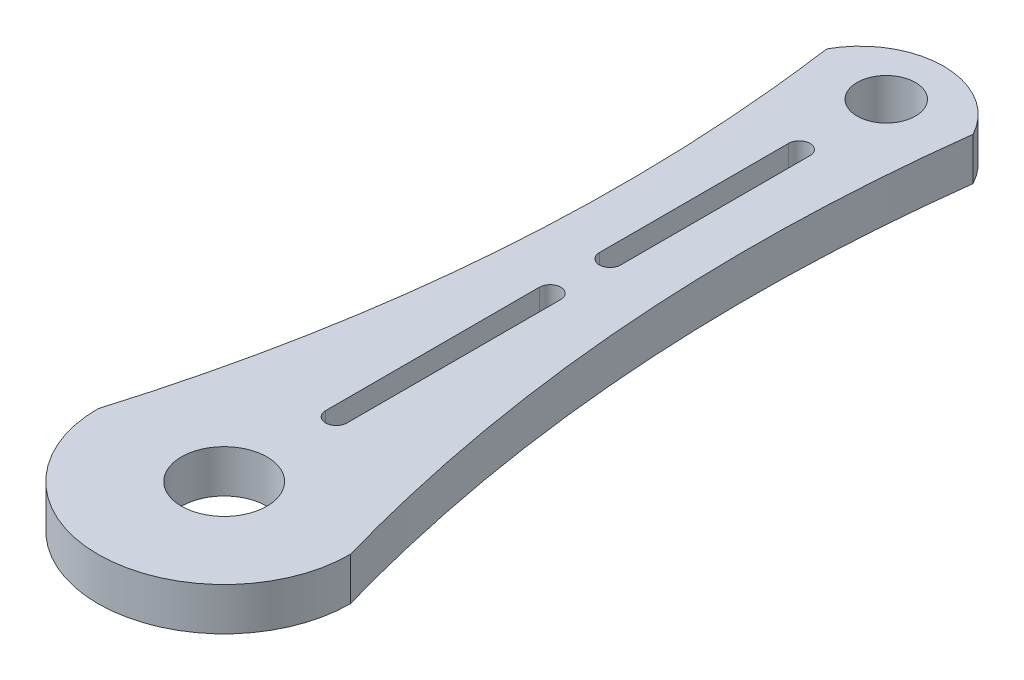
from build123d import *

# Parameters (mm, degrees)
EXTRUDE_1_DEPTH     = 10
CUT_EXTRUDE_1_DEPTH = 172.090332978
CUT_EXTRUDE_2_DEPTH = 172.0903331
SKETCH_4_R          = 6.822924711
CUT_EXTRUDE_3_DEPTH = 172.0903331
SKETCH_5_R          = 10
CUT_EXTRUDE_4_DEPTH = 172.0903331


with BuildPart() as part:
    # 草图1 → 凸台-拉伸1 (new body)
    with BuildSketch(Plane(origin=(0, 0, 0), x_dir=(1, 0, 0), z_dir=(0, 1, 0))):
        with BuildLine():
            Line((-19.5, 150), (-29.5, 0))
            ThreePointArc((-29.5, 0), (0, -29.5), (29.5, 0))
            Line((29.5, 0), (19.47339908, 150.003410942))
            ThreePointArc((19.47339908, 150.003410942), (-0.014895879, 168.230948441), (-19.5, 150))
        make_face()
    extrude(amount=EXTRUDE_1_DEPTH)

    # 草图2 → 切除-拉伸1 (cut, through all)
    with BuildSketch(Plane(origin=(0, 10, 0), x_dir=(1, 0, 0), z_dir=(0, 1, 0))):
        with BuildLine():
            Line((-18.406498031, 166.402529529), (-29.5, 0))
            add(Edge.make_bspline(
                [(-18.406498031, 166.402529529), (-4.887642604, 82.123380262), (-29.5, 0)],
                knots=[0, 0, 0, 1, 1, 1], degree=2))
        make_face()
        with BuildLine():
            Line((18.377392911, 166.400260194), (29.5, 0))
            add(Edge.make_bspline(
                [(18.377392911, 166.400260194), (6.100316571, 82.176287971), (29.5, 0)],
                knots=[0, 0, 0, 1, 1, 1], degree=2))
        make_face()
    extrude(amount=-CUT_EXTRUDE_1_DEPTH, mode=Mode.SUBTRACT)

    # 草图3 → 切除-拉伸2 (cut, through all)
    with BuildSketch(Plane(origin=(0, 10, 0), x_dir=(1, 0, 0), z_dir=(0, 1, 0))):
        with BuildLine():
            Line((-2.5, 90.215422083), (-2.5, 134.474861862))
            ThreePointArc((-2.5, 134.474861862), (0, 136.974861862), (2.5, 134.474861862))
            Line((2.5, 134.474861862), (2.5, 90.215422083))
            ThreePointArc((2.5, 90.215422083), (0, 87.715422083), (-2.5, 90.215422083))
        make_face()
        with BuildLine():
            Line((2.5, 76.205239707), (2.5, 26.214361684))
            ThreePointArc((2.5, 26.214361684), (0, 23.714361684), (-2.5, 26.214361684))
            Line((-2.5, 26.214361684), (-2.5, 76.205239707))
            ThreePointArc((-2.5, 76.205239707), (0, 78.705239707), (2.5, 76.205239707))
        make_face()
    extrude(amount=-CUT_EXTRUDE_2_DEPTH, mode=Mode.SUBTRACT)

    # 草图4 → 切除-拉伸3 (cut, through all)
    with BuildSketch(Plane(origin=(0, 10, 0), x_dir=(1, 0, 0), z_dir=(0, 1, 0))):
        with Locations(Location((0, 154.809118853, 0), (0, 0, 270))):
            Circle(SKETCH_4_R)
    extrude(amount=-CUT_EXTRUDE_3_DEPTH, mode=Mode.SUBTRACT)

    # 草图5 → 切除-拉伸4 (cut, through all)
    with BuildSketch(Plane(origin=(0, 10, 0), x_dir=(1, 0, 0), z_dir=(0, 1, 0))):
        with Locations(Location((0, 0, 0), (0, 0, 270))):
            Circle(SKETCH_5_R)
    extrude(amount=-CUT_EXTRUDE_4_DEPTH, mode=Mode.SUBTRACT)


solid = part.part
